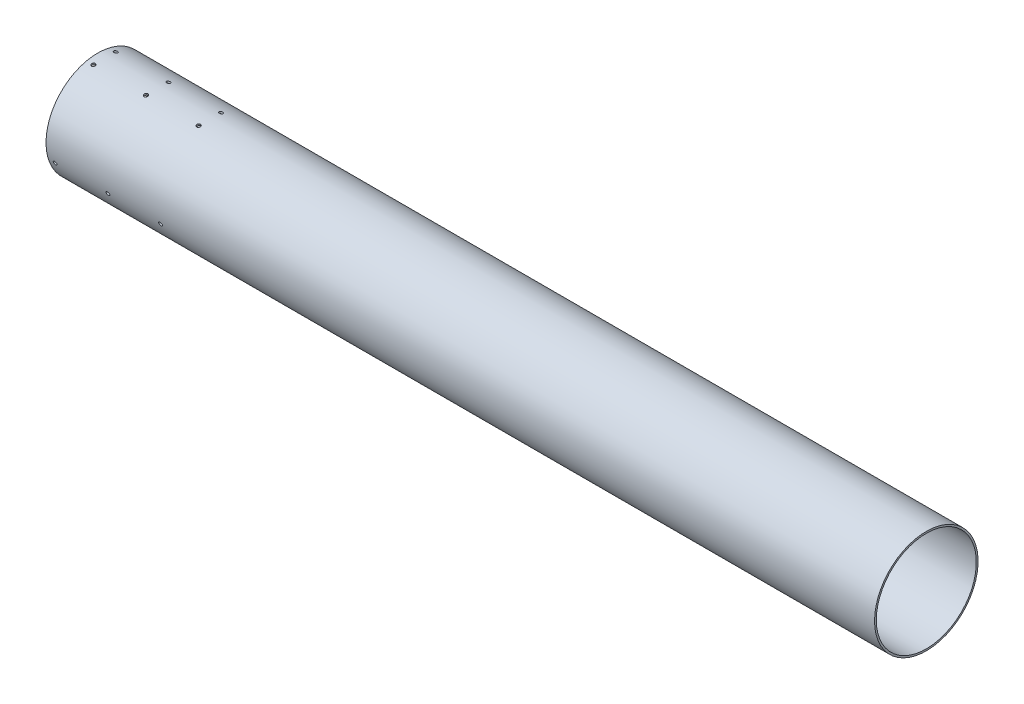
from build123d import *

# Parameters (mm, degrees)
ESQUISSE1_W                  = 1219.2
ESQUISSE1_H                  = 2.5908
D_GAGEMENT_M51_AT_2_COUNT    = 2
D_GAGEMENT_M51_AT_2_PITCH    = 77.5
D_GAGEMENT_M51_AT_3_COUNT    = 2
D_GAGEMENT_M51_AT_3_PITCH    = 155
D_GAGEMENT_M52_AT_2_COUNT    = 2
D_GAGEMENT_M52_AT_2_PITCH    = 77.5
D_GAGEMENT_M52_AT_3_COUNT    = 2
D_GAGEMENT_M52_AT_3_PITCH    = 155
R_P_TITION_CIRCULAIRE1_COUNT = 3


with BuildPart() as part:
    # Esquisse1 → Révolution1 (revolve)
    with BuildSketch(Plane.XY, mode=Mode.PRIVATE) as r_volution1_sk:
        with Locations((609.6, 74.9046)):
            Rectangle(ESQUISSE1_W, ESQUISSE1_H)
    revolve(r_volution1_sk.sketch.rotate(Axis((0, 0, 0), (1, 0, 0)), 90), axis=Axis((0, 0, 0), (1, 0, 0)))

    # Esquisse3 → Dégagement M51 (revolve, cut)
    with BuildSketch(Plane(origin=(165, 74.414937566, -16.525995139), x_dir=(0, 0.19031201002510603, 0.9817236570645551), z_dir=(1, 0, 0))):
        Polygon((0, 0), (0, 11.652366702), (2.75, 10), (2.75, 0), align=None)
    d_gagement_m51 = revolve(axis=Axis((165, 80.648882788, -17.734476403), (0, -0.981723657064555, 0.190312010025106)), mode=Mode.SUBTRACT)

    # Dégagement M51 at 2: Dégagement M51 ×2
    with Locations(*[(-i * D_GAGEMENT_M51_AT_2_PITCH, 0, 0) for i in range(1, D_GAGEMENT_M51_AT_2_COUNT)]):
        add(d_gagement_m51, mode=Mode.SUBTRACT)

    # Dégagement M51 at 3: Dégagement M51 ×2
    with Locations(*[(-i * D_GAGEMENT_M51_AT_3_PITCH, 0, 0) for i in range(1, D_GAGEMENT_M51_AT_3_COUNT)]):
        add(d_gagement_m51, mode=Mode.SUBTRACT)

    # Esquisse5 → Dégagement M52 (revolve, cut)
    with BuildSketch(Plane(origin=(10, 74.414937566, 16.525995139), x_dir=(0, -0.19031201002510603, 0.9817236570645551), z_dir=(1, 0, 0))):
        Polygon((0, 0), (0, 11.652366702), (2.75, 10), (2.75, 0), align=None)
    d_gagement_m52 = revolve(axis=Axis((10, 80.648882788, 17.734476403), (0, -0.981723657064555, -0.190312010025106)), mode=Mode.SUBTRACT)

    # Dégagement M52 at 2: Dégagement M52 ×2
    with Locations(*[(i * D_GAGEMENT_M52_AT_2_PITCH, 0, 0) for i in range(1, D_GAGEMENT_M52_AT_2_COUNT)]):
        add(d_gagement_m52, mode=Mode.SUBTRACT)

    # Dégagement M52 at 3: Dégagement M52 ×2
    with Locations(*[(i * D_GAGEMENT_M52_AT_3_PITCH, 0, 0) for i in range(1, D_GAGEMENT_M52_AT_3_COUNT)]):
        add(d_gagement_m52, mode=Mode.SUBTRACT)

    # Répétition circulaire1: Dégagement M51, Dégagement M52 ×3 about axis
    r_p_tition_circulaire1_axis = Axis((1219.2, 0, 0), (-1, 0, 0))
    add([d_gagement_m51.rotate(r_p_tition_circulaire1_axis, i * 360 / R_P_TITION_CIRCULAIRE1_COUNT) for i in range(1, R_P_TITION_CIRCULAIRE1_COUNT)], mode=Mode.SUBTRACT)
    add([d_gagement_m52.rotate(r_p_tition_circulaire1_axis, i * 360 / R_P_TITION_CIRCULAIRE1_COUNT) for i in range(1, R_P_TITION_CIRCULAIRE1_COUNT)], mode=Mode.SUBTRACT)

    # Répétition circulaire1 copy 1 sketch → Répétition circulaire1 copy 1 (revolve, cut)
    with BuildSketch(Plane(origin=(87.5, -51.519400396, -56.182228784), x_dir=(0, 0.7550416215015142, -0.6556768638592979), z_dir=(1, 0, 0))):
        Polygon((0, 0), (0, 11.652366702), (2.75, 10), (2.75, 0), align=None)
    revolve(axis=Axis((87.5, -55.682948482, -60.97674308), (0, 0.6556768638592978, 0.7550416215015141)), mode=Mode.SUBTRACT)

    # Répétition circulaire1 copy 2 sketch → Répétition circulaire1 copy 2 (revolve, cut)
    with BuildSketch(Plane(origin=(87.5, -22.89553717, 72.708223923), x_dir=(0, -0.9453536315266199, -0.3260467932052574), z_dir=(1, 0, 0))):
        Polygon((0, 0), (0, 11.652366702), (2.75, 10), (2.75, 0), align=None)
    revolve(axis=Axis((87.5, -24.965934307, 78.711219483), (0, 0.3260467932052574, -0.9453536315266198)), mode=Mode.SUBTRACT)

    # Répétition circulaire1 copy 3 sketch → Répétition circulaire1 copy 3 (revolve, cut)
    with BuildSketch(Plane(origin=(10, -51.519400396, -56.182228784), x_dir=(0, 0.7550416215015142, -0.6556768638592979), z_dir=(1, 0, 0))):
        Polygon((0, 0), (0, 11.652366702), (2.75, 10), (2.75, 0), align=None)
    revolve(axis=Axis((10, -55.682948482, -60.97674308), (0, 0.6556768638592978, 0.7550416215015141)), mode=Mode.SUBTRACT)

    # Répétition circulaire1 copy 4 sketch → Répétition circulaire1 copy 4 (revolve, cut)
    with BuildSketch(Plane(origin=(10, -22.89553717, 72.708223923), x_dir=(0, -0.9453536315266199, -0.3260467932052574), z_dir=(1, 0, 0))):
        Polygon((0, 0), (0, 11.652366702), (2.75, 10), (2.75, 0), align=None)
    revolve(axis=Axis((10, -24.965934307, 78.711219483), (0, 0.3260467932052574, -0.9453536315266198)), mode=Mode.SUBTRACT)

    # Répétition circulaire1 copy 5 sketch → Répétition circulaire1 copy 5 (revolve, cut)
    with BuildSketch(Plane(origin=(87.5, -22.89553717, -72.708223923), x_dir=(0, 0.9453536315266201, -0.32604679320525676), z_dir=(1, 0, 0))):
        Polygon((0, 0), (0, 11.652366702), (2.75, 10), (2.75, 0), align=None)
    revolve(axis=Axis((87.5, -24.965934307, -78.711219483), (0, 0.3260467932052567, 0.94535363152662)), mode=Mode.SUBTRACT)

    # Répétition circulaire1 copy 6 sketch → Répétition circulaire1 copy 6 (revolve, cut)
    with BuildSketch(Plane(origin=(87.5, -51.519400396, 56.182228784), x_dir=(0, -0.7550416215015138, -0.6556768638592986), z_dir=(1, 0, 0))):
        Polygon((0, 0), (0, 11.652366702), (2.75, 10), (2.75, 0), align=None)
    revolve(axis=Axis((87.5, -55.682948482, 60.97674308), (0, 0.6556768638592985, -0.7550416215015137)), mode=Mode.SUBTRACT)

    # Répétition circulaire1 copy 7 sketch → Répétition circulaire1 copy 7 (revolve, cut)
    with BuildSketch(Plane(origin=(165, -22.89553717, -72.708223923), x_dir=(0, 0.9453536315266201, -0.32604679320525676), z_dir=(1, 0, 0))):
        Polygon((0, 0), (0, 11.652366702), (2.75, 10), (2.75, 0), align=None)
    revolve(axis=Axis((165, -24.965934307, -78.711219483), (0, 0.3260467932052567, 0.94535363152662)), mode=Mode.SUBTRACT)

    # Répétition circulaire1 copy 8 sketch → Répétition circulaire1 copy 8 (revolve, cut)
    with BuildSketch(Plane(origin=(165, -51.519400396, 56.182228784), x_dir=(0, -0.7550416215015138, -0.6556768638592986), z_dir=(1, 0, 0))):
        Polygon((0, 0), (0, 11.652366702), (2.75, 10), (2.75, 0), align=None)
    revolve(axis=Axis((165, -55.682948482, 60.97674308), (0, 0.6556768638592985, -0.7550416215015137)), mode=Mode.SUBTRACT)


solid = part.part
